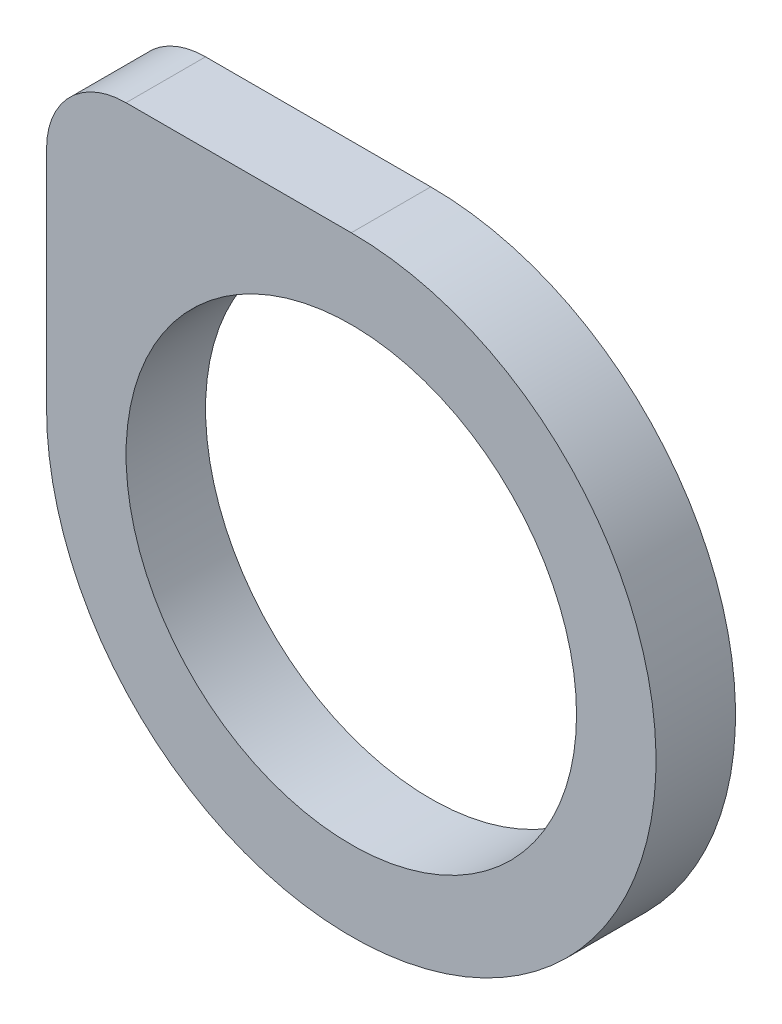
from build123d import *

# Parameters (mm, degrees)
SKETCH1_R           = 8.5
BOSS_EXTRUDE1_DEPTH = 3


with BuildPart() as part:
    # Sketch1 → Boss-Extrude1 (new body)
    with BuildSketch(Plane.XY):
        with BuildLine():
            Line((-11.5, 0), (-11.5, 8.5))
            ThreePointArc((-11.5, 8.5), (-10.621320344, 10.621320344), (-8.5, 11.5))
            Line((-8.5, 11.5), (0, 11.5))
            ThreePointArc((0, 11.5), (8.131727984, -8.131727984), (-11.5, 0))
        make_face()
        Circle(SKETCH1_R, mode=Mode.SUBTRACT)
    extrude(amount=BOSS_EXTRUDE1_DEPTH)


solid = part.part
